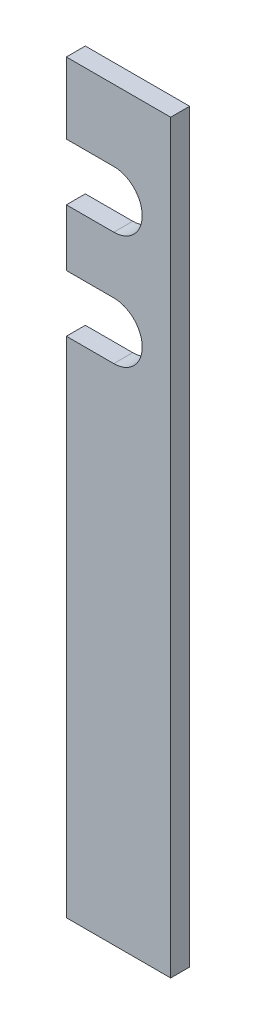
from build123d import *

# Parameters (mm, degrees)
SKETCH1_W           = 5.5
SKETCH1_H           = 39.3
BOSS_EXTRUDE1_DEPTH = 1
CUT_EXTRUDE2_DEPTH  = 1


with BuildPart() as part:
    # Sketch1 → Boss-Extrude1 (new body)
    with BuildSketch(Plane.XY):
        Rectangle(SKETCH1_W, SKETCH1_H)
    extrude(amount=BOSS_EXTRUDE1_DEPTH)

    # Sketch2 → Cut-Extrude2 (cut)
    with BuildSketch(Plane.XY.offset(1)):
        with BuildLine():
            ThreePointArc((-0.25, 12.9), (-1.75, 14.4), (-0.25, 15.9))
            Line((-0.25, 15.9), (-2.75, 15.9))
            Line((-2.75, 15.9), (-2.75, 12.9))
            Line((-2.75, 12.9), (-0.25, 12.9))
        make_face()
        with BuildLine():
            ThreePointArc((1.25, 14.4), (0.810660172, 15.460660172), (-0.25, 15.9))
            Line((-0.25, 15.9), (-0.25, 12.9))
            ThreePointArc((-0.25, 12.9), (0.810660172, 13.339339828), (1.25, 14.4))
        make_face()
        with BuildLine():
            Line((-0.25, 12.9), (-0.25, 15.9))
            ThreePointArc((-0.25, 15.9), (-1.75, 14.4), (-0.25, 12.9))
        make_face()
        with BuildLine():
            Line((-0.25, 9.9), (-2.75, 9.9))
            Line((-2.75, 9.9), (-2.75, 6.9))
            Line((-2.75, 6.9), (-0.25, 6.9))
            ThreePointArc((-0.25, 6.9), (-1.75, 8.4), (-0.25, 9.9))
        make_face()
        with BuildLine():
            ThreePointArc((1.25, 8.4), (0.810660172, 9.460660172), (-0.25, 9.9))
            Line((-0.25, 9.9), (-0.25, 6.9))
            ThreePointArc((-0.25, 6.9), (0.810660172, 7.339339828), (1.25, 8.4))
        make_face()
        with BuildLine():
            Line((-0.25, 6.9), (-0.25, 9.9))
            ThreePointArc((-0.25, 9.9), (-1.75, 8.4), (-0.25, 6.9))
        make_face()
    extrude(amount=-CUT_EXTRUDE2_DEPTH, mode=Mode.SUBTRACT)


solid = part.part
